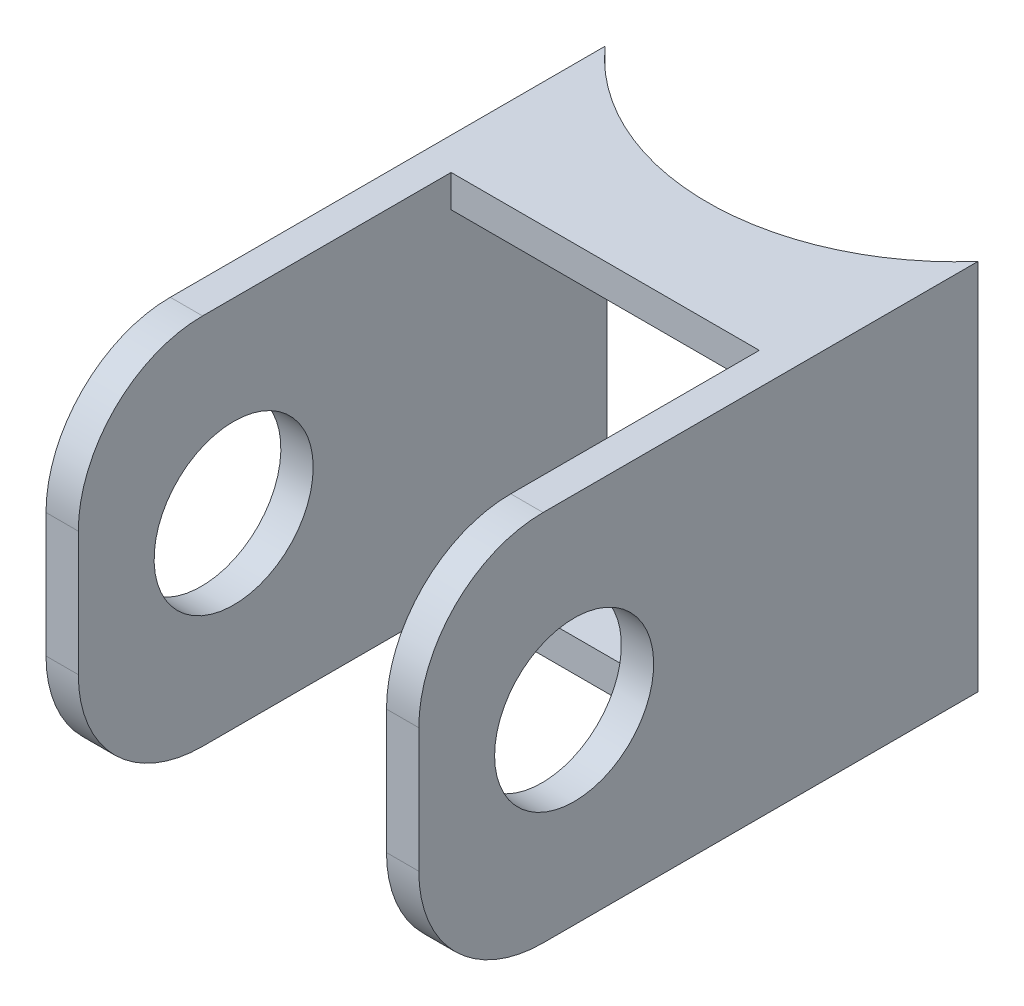
from build123d import *

# Parameters (mm, degrees)
SKETCH1_W               = 19.05
SKETCH1_H               = 19.05
SKETCH1_W_2             = 15.748
SKETCH1_H_2             = 15.748
BOSS_EXTRUDE1_DEPTH     = 28.575
CUT_EXTRUDE5_DEPTH      = 36.639286609
CUT_EXTRUDE5_DEPTH_BACK = 36.639286609
SKETCH5_R               = 12.7
CUT_EXTRUDE2_DEPTH      = 36.639286609
CUT_EXTRUDE2_DEPTH_BACK = 36.639286609
SKETCH3_R               = 4.064
CUT_EXTRUDE4_DEPTH      = 36.639286609
CUT_EXTRUDE4_DEPTH_BACK = 36.639286609
SKETCH4_W               = 15.748
SKETCH4_H               = 19.05
FILLET2_R               = 6.35


with BuildPart() as part:
    # Sketch1 → Boss-Extrude1 (new body)
    with BuildSketch(Plane.XY):
        Rectangle(SKETCH1_W, SKETCH1_H)
        Rectangle(SKETCH1_W_2, SKETCH1_H_2, mode=Mode.SUBTRACT)
    extrude(amount=BOSS_EXTRUDE1_DEPTH)

    # Sketch5 → Cut-Extrude5 (cut, two sides: drawn at the far end of the back side and taken through both)
    with BuildSketch(Plane(origin=(0, 9.525, 0), x_dir=(1, 0, 0), z_dir=(0, 1, 0)).offset(-CUT_EXTRUDE5_DEPTH_BACK)):
        with Locations((0, 8.400260413)):
            Circle(SKETCH5_R)
    extrude(amount=CUT_EXTRUDE5_DEPTH + CUT_EXTRUDE5_DEPTH_BACK, mode=Mode.SUBTRACT)

    # Sketch3 → Cut-Extrude2 (cut, two sides: drawn at the far end of the back side and taken through both)
    with BuildSketch(Plane(origin=(9.525, 0, 0), x_dir=(0, 0, -1), z_dir=(1, 0, 0)).offset(-CUT_EXTRUDE2_DEPTH_BACK)):
        with Locations((-20.6375, 0)):
            Circle(SKETCH3_R)
    extrude(amount=CUT_EXTRUDE2_DEPTH + CUT_EXTRUDE2_DEPTH_BACK, mode=Mode.SUBTRACT)

    # Sketch4 → Cut-Extrude4 (cut, two sides: drawn at the far end of the back side and taken through both)
    with BuildSketch(Plane.XZ.offset(9.525).offset(-CUT_EXTRUDE4_DEPTH_BACK)):
        with Locations((0, 19.05)):
            Rectangle(SKETCH4_W, SKETCH4_H)
    extrude(amount=CUT_EXTRUDE4_DEPTH + CUT_EXTRUDE4_DEPTH_BACK, mode=Mode.SUBTRACT)

    # Fillet2
    fillet2_edges = [part.edges().sort_by_distance(p)[0] for p in [
        (-8.6995, 9.525, 28.575),
        (8.6995, 9.525, 28.575),
        (-8.6995, -9.525, 28.575),
        (8.6995, -9.525, 28.575),
    ]]
    fillet(fillet2_edges, radius=FILLET2_R)


solid = part.part
